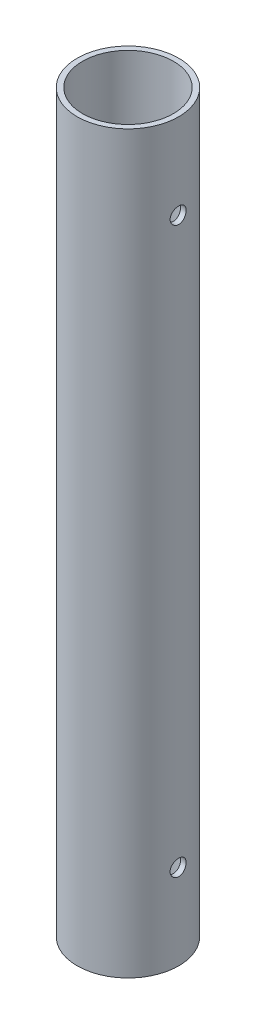
from build123d import *

# Parameters (mm, degrees)
SKETCH2_R           = 60.49
SKETCH2_R_2         = 54.14
BOSS_EXTRUDE1_DEPTH = 876.3
SKETCH3_R           = 9.525
CUT_EXTRUDE1_DEPTH  = 438.15


with BuildPart() as part:
    # Sketch2 → Boss-Extrude1 (new body)
    with BuildSketch(Plane(origin=(0, 0, 0), x_dir=(1, 0, 0), z_dir=(0, 1, 0))):
        with Locations(Location((0, 0, 0), (0, 0, 270))):
            Circle(SKETCH2_R)
        with Locations(Location((0, 0, 0), (0, 0, 270))):
            Circle(SKETCH2_R_2, mode=Mode.SUBTRACT)
    extrude(amount=BOSS_EXTRUDE1_DEPTH)

    # Sketch3 → Cut-Extrude1 (cut, symmetric)
    with BuildSketch(Plane(origin=(0, 0, 0), x_dir=(0, 0, -1), z_dir=(1, 0, 0))):
        with Locations((0, 101.6)):
            Circle(SKETCH3_R)
        with Locations((0, 774.7)):
            Circle(SKETCH3_R)
    extrude(amount=CUT_EXTRUDE1_DEPTH, both=True, mode=Mode.SUBTRACT)


solid = part.part
